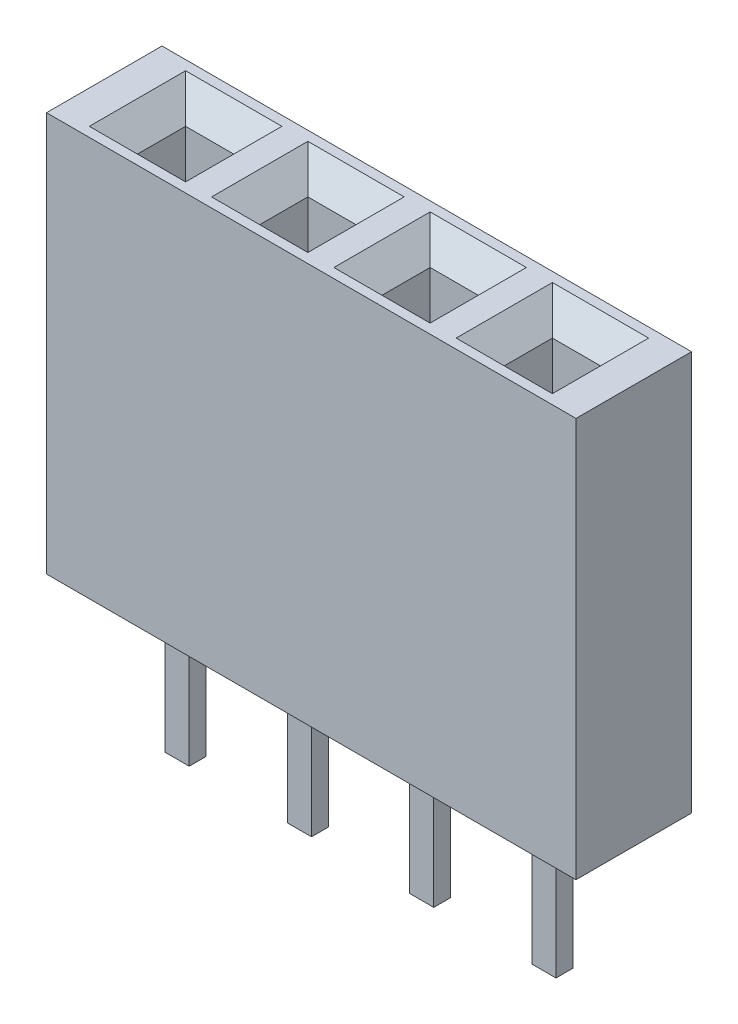
from build123d import *

# Parameters (mm, degrees)
SKETCH3_W           = 11
SKETCH3_H           = 8.3
BOSS_EXTRUDE1_DEPTH = 2.4
SKETCH5_W           = 1
SKETCH5_H           = 1
CUT_EXTRUDE1_DEPTH  = 5
CHAMFER1_SIZE       = 0.5
SKETCH4_W           = 0.5
SKETCH4_H           = 0.35
BOSS_EXTRUDE2_DEPTH = 3


with BuildPart() as part:
    # Sketch3 → Boss-Extrude1 (new body)
    with BuildSketch(Plane.XY):
        Rectangle(SKETCH3_W, SKETCH3_H)
    extrude(amount=BOSS_EXTRUDE1_DEPTH)

    # Sketch5 → Cut-Extrude1 (cut)
    with BuildSketch(Plane(origin=(0, 4.15, 0), x_dir=(1, 0, 0), z_dir=(0, 1, 0))):
        with Locations((-3.81, -1.2)):
            Rectangle(SKETCH5_W, SKETCH5_H)
        with Locations((-1.27, -1.2)):
            Rectangle(SKETCH5_W, SKETCH5_H)
        with Locations((1.27, -1.2)):
            Rectangle(SKETCH5_W, SKETCH5_H)
        with Locations((3.81, -1.2)):
            Rectangle(SKETCH5_W, SKETCH5_H)
    extrude(amount=-CUT_EXTRUDE1_DEPTH, mode=Mode.SUBTRACT)

    # Chamfer1
    chamfer1_edges = [part.edges().sort_by_distance(p)[0] for p in [
        (-3.31, 4.15, 1.2),
        (-3.81, 4.15, 0.7),
        (-4.31, 4.15, 1.2),
        (-3.81, 4.15, 1.7),
        (-1.27, 4.15, 1.7),
        (-0.77, 4.15, 1.2),
        (-1.27, 4.15, 0.7),
        (-1.77, 4.15, 1.2),
        (1.27, 4.15, 1.7),
        (1.77, 4.15, 1.2),
        (1.27, 4.15, 0.7),
        (0.77, 4.15, 1.2),
        (3.81, 4.15, 1.7),
        (4.31, 4.15, 1.2),
        (3.81, 4.15, 0.7),
        (3.31, 4.15, 1.2),
    ]]
    chamfer(chamfer1_edges, length=CHAMFER1_SIZE)

    # Sketch4 → Boss-Extrude2 (add)
    with BuildSketch(Plane.XZ.offset(4.15)):
        with Locations((-1.27, 1.2)):
            Rectangle(SKETCH4_W, SKETCH4_H)
        with Locations((-3.81, 1.2)):
            Rectangle(SKETCH4_W, SKETCH4_H)
        with Locations((1.27, 1.2)):
            Rectangle(SKETCH4_W, SKETCH4_H)
        with Locations((3.81, 1.2)):
            Rectangle(SKETCH4_W, SKETCH4_H)
    extrude(amount=BOSS_EXTRUDE2_DEPTH)


solid = part.part
